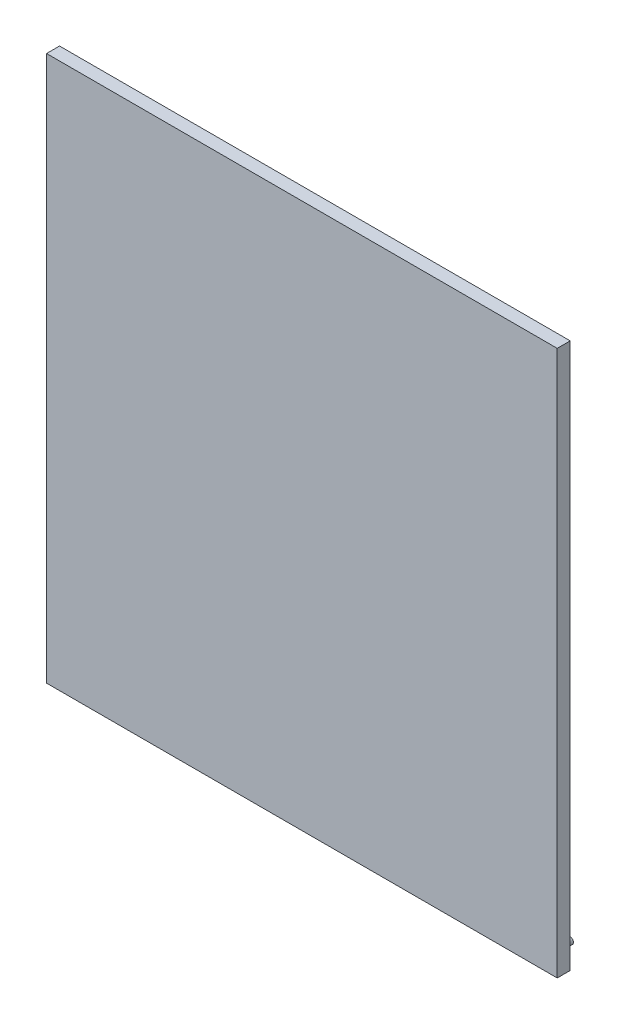
from build123d import *

# Parameters (mm, degrees)
ESQUISSE1_W        = 1180
ESQUISSE1_H        = 1260
BOSS_EXTRU_2_DEPTH = 30
ESQUISSE3_R        = 7.5
BOSS_EXTRU_3_DEPTH = 30


with BuildPart() as part:
    # Esquisse1 → Boss.-Extru.2 (new body)
    with BuildSketch(Plane.XY):
        with Locations((590, 630)):
            Rectangle(ESQUISSE1_W, ESQUISSE1_H)
    extrude(amount=BOSS_EXTRU_2_DEPTH)

    # Esquisse3 → Boss.-Extru.3 (add)
    with BuildSketch(Plane(origin=(0, 0, 0), x_dir=(-1, 0, 0), z_dir=(0, 0, -1))):
        with Locations((-1150, 30)):
            Circle(ESQUISSE3_R)
        with Locations((-30, 30)):
            Circle(ESQUISSE3_R)
    extrude(amount=BOSS_EXTRU_3_DEPTH)


solid = part.part
